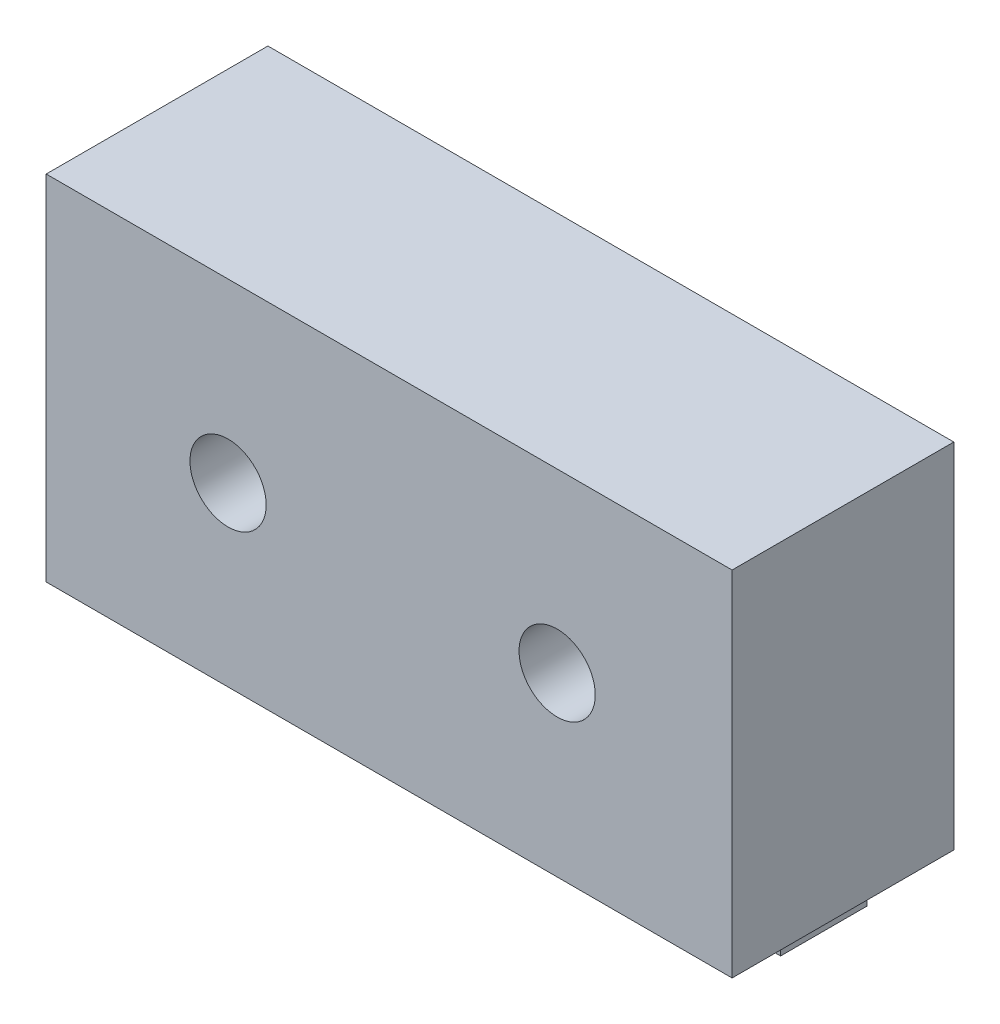
from build123d import *

# Parameters (mm, degrees)
CASE_SKETCH_W        = 19.8
CASE_SKETCH_H        = 10.2
CASE_2_DEPTH         = 6.4
SCREW_HOLES_SKETCH_R = 1.1
SCREW_HOLES_DEPTH    = 30
PLUNGER_SKETCH_W     = 2.5
PLUNGER_SKETCH_H     = 0.7
PLUNGER_DEPTH        = 2.5


with BuildPart() as part:
    # Case Sketch → Case 2 (new body)
    with BuildSketch(Plane.XY.offset(13.6)):
        with Locations((-856.1, 155.6)):
            Rectangle(CASE_SKETCH_W, CASE_SKETCH_H)
    extrude(amount=CASE_2_DEPTH)

    # Screw Holes Sketch → Screw Holes (cut, symmetric)
    with BuildSketch(Plane.XY):
        with Locations((-860.75, 155.6)):
            Circle(SCREW_HOLES_SKETCH_R)
        with Locations((-851.25, 155.6)):
            Circle(SCREW_HOLES_SKETCH_R)
    extrude(amount=SCREW_HOLES_DEPTH, both=True, mode=Mode.SUBTRACT)

    # Plunger Sketch → Plunger (add)
    with BuildSketch(Plane.XY.offset(15.55)):
        with Locations((-848, 150.15)):
            Rectangle(PLUNGER_SKETCH_W, PLUNGER_SKETCH_H)
    extrude(amount=PLUNGER_DEPTH)


solid = part.part
